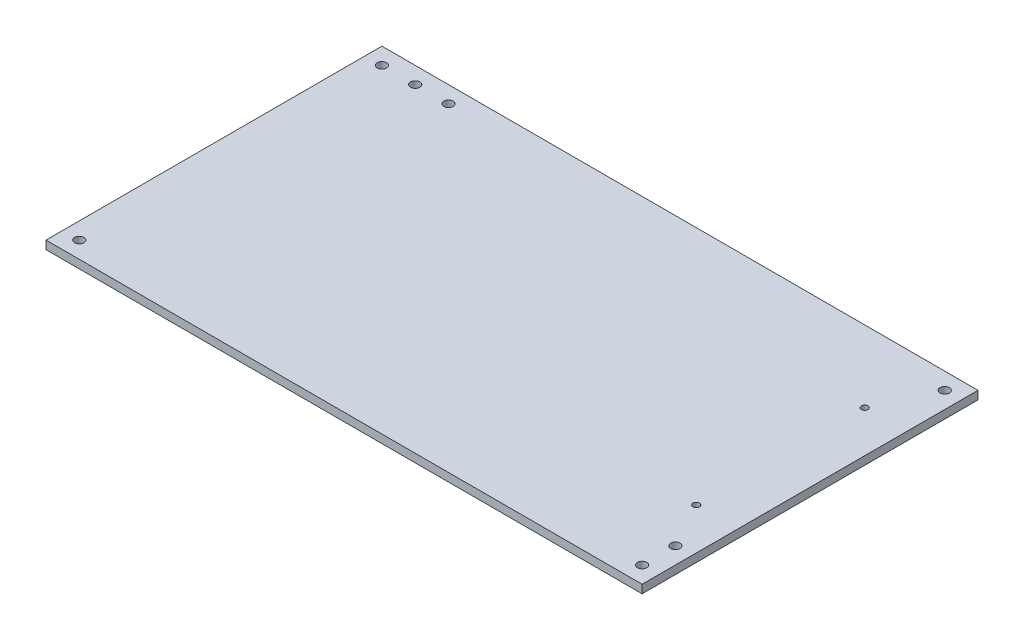
from build123d import *

# Parameters (mm, degrees)
BOSS_EXTRUDE1_START              = 19.05
SKETCH2_W                        = 600
SKETCH2_H                        = 256.45
BOSS_EXTRUDE1_DEPTH              = 6.35
BOSS_EXTRUDE2_START              = 19.05
SKETCH2_4_W                      = 455.092
SKETCH2_4_H                      = 256.45
BOSS_EXTRUDE2_DEPTH              = 6.35
BOSS_EXTRUDE3_START              = 19.05
SKETCH2_5_W                      = 455.092
SKETCH2_5_H                      = 300
BOSS_EXTRUDE3_DEPTH              = 6.35
SKETCH8_W                        = 3.5687
SKETCH8_H                        = 6.35
F_1_4_CLEARANCE_HOLE2_AT_2_COUNT = 2
F_1_4_CLEARANCE_HOLE2_AT_2_PITCH = 231.05
F_1_4_CLEARANCE_HOLE2_AT_3_COUNT = 2
F_1_4_CLEARANCE_HOLE2_AT_3_PITCH = 595.822744195
F_1_4_CLEARANCE_HOLE2_AT_4_COUNT = 2
F_1_4_CLEARANCE_HOLE2_AT_4_PITCH = 619.31354135
F_1_4_CLEARANCE_HOLE2_AT_5_COUNT = 2
F_1_4_CLEARANCE_HOLE2_AT_5_PITCH = 523.8
F_1_4_CLEARANCE_HOLE2_AT_6_COUNT = 2
F_1_4_CLEARANCE_HOLE2_AT_6_PITCH = 549.2
F_1_4_CLEARANCE_HOLE2_AT_7_COUNT = 2
F_1_4_CLEARANCE_HOLE2_AT_7_PITCH = 574.6
SKETCH10_W                       = 3.5687
SKETCH10_H                       = 6.35
F_1_4_CLEARANCE_HOLE3_AT_2_COUNT = 2
F_1_4_CLEARANCE_HOLE3_AT_2_PITCH = 25.4
F_1_4_CLEARANCE_HOLE3_AT_3_COUNT = 2
F_1_4_CLEARANCE_HOLE3_AT_3_PITCH = 50.8
F_1_4_CLEARANCE_HOLE3_AT_4_COUNT = 2
F_1_4_CLEARANCE_HOLE3_AT_4_PITCH = 231.05
F_1_4_CLEARANCE_HOLE3_AT_5_COUNT = 2
F_1_4_CLEARANCE_HOLE3_AT_5_PITCH = 487.872234672
F_1_4_CLEARANCE_HOLE3_AT_6_COUNT = 2
F_1_4_CLEARANCE_HOLE3_AT_6_PITCH = 476.368698976
F_1_4_CLEARANCE_HOLE3_AT_7_COUNT = 2
F_1_4_CLEARANCE_HOLE3_AT_7_PITCH = 429.692
SKETCH12_W                       = 3.5687
SKETCH12_H                       = 6.35
F_1_4_CLEARANCE_HOLE4_AT_2_COUNT = 2
F_1_4_CLEARANCE_HOLE4_AT_2_PITCH = 25.4
F_1_4_CLEARANCE_HOLE4_AT_3_COUNT = 2
F_1_4_CLEARANCE_HOLE4_AT_3_PITCH = 249.2
F_1_4_CLEARANCE_HOLE4_AT_4_COUNT = 2
F_1_4_CLEARANCE_HOLE4_AT_4_PITCH = 496.725130091
F_1_4_CLEARANCE_HOLE4_AT_5_COUNT = 2
F_1_4_CLEARANCE_HOLE4_AT_5_PITCH = 429.692
F_1_4_CLEARANCE_HOLE4_AT_6_COUNT = 2
F_1_4_CLEARANCE_HOLE4_AT_6_PITCH = 430.442069115
SKETCH14_W                       = 2.4892
SKETCH14_H                       = 6.35
F_8_CLEARANCE_HOLE2_AT_2_COUNT   = 2
F_8_CLEARANCE_HOLE2_AT_2_PITCH   = 128.5875
SKETCH16_W                       = 2.4892
SKETCH16_H                       = 6.35
F_8_CLEARANCE_HOLE3_AT_2_COUNT   = 2
F_8_CLEARANCE_HOLE3_AT_2_PITCH   = 128.5875
SKETCH17_R                       = 3.5687
BOSS_EXTRUDE4_DEPTH              = 6.35
FILLET2_R                        = 6.35
SKETCH18_W                       = 152.4
SKETCH18_H                       = 25.4
SKETCH18_R                       = 3.5687
BOSS_EXTRUDE5_DEPTH              = 6.35
SKETCH19_W                       = 25.4
SKETCH19_H                       = 101.6
SKETCH19_R                       = 3.5687
BOSS_EXTRUDE6_DEPTH              = 6.35


with BuildPart() as part:
    # Sketch2 → Boss-Extrude1 (new body)
    with BuildSketch(Plane(origin=(0, 0, 0), x_dir=(1, 0, 0), z_dir=(0, 1, 0)).offset(BOSS_EXTRUDE1_START)):
        with Locations((0, 278.225)):
            Rectangle(SKETCH2_W, SKETCH2_H)
    extrude(amount=BOSS_EXTRUDE1_DEPTH)

    # Sketch8 → 1/4 Clearance Hole2 (revolve, cut)
    with BuildSketch(Plane(origin=(-287.3, 25.4, -393.75), x_dir=(0, 0, 1), z_dir=(1, 0, 0))):
        with Locations((1.78435, 3.175)):
            Rectangle(SKETCH8_W, SKETCH8_H)
    f_1_4_clearance_hole2 = revolve(axis=Axis((-287.3, 31.75, -393.75), (0, -1, 0)), mode=Mode.SUBTRACT)

    # 1/4 Clearance Hole2 at 2: 1/4 Clearance Hole2 ×2
    with Locations(*[(0, 0, i * F_1_4_CLEARANCE_HOLE2_AT_2_PITCH) for i in range(1, F_1_4_CLEARANCE_HOLE2_AT_2_COUNT)]):
        add(f_1_4_clearance_hole2, mode=Mode.SUBTRACT)

    # 1/4 Clearance Hole2 at 3: 1/4 Clearance Hole2 ×2
    with Locations(*[Vector(0.9217506470687957, 0, 0.3877831154501913) * (i * F_1_4_CLEARANCE_HOLE2_AT_3_PITCH) for i in range(1, F_1_4_CLEARANCE_HOLE2_AT_3_COUNT)]):
        add(f_1_4_clearance_hole2, mode=Mode.SUBTRACT)

    # 1/4 Clearance Hole2 at 4: 1/4 Clearance Hole2 ×2
    with Locations(*[Vector(0.9278014473041833, 0, 0.37307435502894426) * (i * F_1_4_CLEARANCE_HOLE2_AT_4_PITCH) for i in range(1, F_1_4_CLEARANCE_HOLE2_AT_4_COUNT)]):
        add(f_1_4_clearance_hole2, mode=Mode.SUBTRACT)

    # 1/4 Clearance Hole2 at 5: 1/4 Clearance Hole2 ×2
    with Locations(*[(i * F_1_4_CLEARANCE_HOLE2_AT_5_PITCH, 0, 0) for i in range(1, F_1_4_CLEARANCE_HOLE2_AT_5_COUNT)]):
        add(f_1_4_clearance_hole2, mode=Mode.SUBTRACT)

    # 1/4 Clearance Hole2 at 6: 1/4 Clearance Hole2 ×2
    with Locations(*[(i * F_1_4_CLEARANCE_HOLE2_AT_6_PITCH, 0, 0) for i in range(1, F_1_4_CLEARANCE_HOLE2_AT_6_COUNT)]):
        add(f_1_4_clearance_hole2, mode=Mode.SUBTRACT)

    # 1/4 Clearance Hole2 at 7: 1/4 Clearance Hole2 ×2
    with Locations(*[(i * F_1_4_CLEARANCE_HOLE2_AT_7_PITCH, 0, 0) for i in range(1, F_1_4_CLEARANCE_HOLE2_AT_7_COUNT)]):
        add(f_1_4_clearance_hole2, mode=Mode.SUBTRACT)

    # Sketch14 → #8 Clearance Hole2 (revolve, cut)
    with BuildSketch(Plane(origin=(-268.25, 25.4, -351.68125), x_dir=(0, 0, 1), z_dir=(1, 0, 0))):
        with Locations((1.2446, 3.175)):
            Rectangle(SKETCH14_W, SKETCH14_H)
    f_8_clearance_hole2 = revolve(axis=Axis((-268.25, 31.75, -351.68125), (0, -1, 0)), mode=Mode.SUBTRACT)

    # #8 Clearance Hole2 at 2: #8 Clearance Hole2 ×2
    with Locations(*[(0, 0, i * F_8_CLEARANCE_HOLE2_AT_2_PITCH) for i in range(1, F_8_CLEARANCE_HOLE2_AT_2_COUNT)]):
        add(f_8_clearance_hole2, mode=Mode.SUBTRACT)


with BuildPart() as body_2:
    # Sketch2<4> → Boss-Extrude2 (new body)
    with BuildSketch(Plane(origin=(0, 0, 0), x_dir=(1, 0, 0), z_dir=(0, 1, 0)).offset(BOSS_EXTRUDE2_START)):
        with Locations((527.546, 278.225)):
            Rectangle(SKETCH2_4_W, SKETCH2_4_H)
    extrude(amount=BOSS_EXTRUDE2_DEPTH)

    # Sketch10 → 1/4 Clearance Hole3 (revolve, cut)
    with BuildSketch(Plane(origin=(312.7, 25.4, -393.75), x_dir=(0, 0, 1), z_dir=(1, 0, 0))):
        with Locations((1.78435, 3.175)):
            Rectangle(SKETCH10_W, SKETCH10_H)
    f_1_4_clearance_hole3 = revolve(axis=Axis((312.7, 31.75, -393.75), (0, -1, 0)), mode=Mode.SUBTRACT)

    # 1/4 Clearance Hole3 at 2: 1/4 Clearance Hole3 ×2
    with Locations(*[(i * F_1_4_CLEARANCE_HOLE3_AT_2_PITCH, 0, 0) for i in range(1, F_1_4_CLEARANCE_HOLE3_AT_2_COUNT)]):
        add(f_1_4_clearance_hole3, mode=Mode.SUBTRACT)

    # 1/4 Clearance Hole3 at 3: 1/4 Clearance Hole3 ×2
    with Locations(*[(i * F_1_4_CLEARANCE_HOLE3_AT_3_PITCH, 0, 0) for i in range(1, F_1_4_CLEARANCE_HOLE3_AT_3_COUNT)]):
        add(f_1_4_clearance_hole3, mode=Mode.SUBTRACT)

    # 1/4 Clearance Hole3 at 4: 1/4 Clearance Hole3 ×2
    with Locations(*[(0, 0, i * F_1_4_CLEARANCE_HOLE3_AT_4_PITCH) for i in range(1, F_1_4_CLEARANCE_HOLE3_AT_4_COUNT)]):
        add(f_1_4_clearance_hole3, mode=Mode.SUBTRACT)

    # 1/4 Clearance Hole3 at 5: 1/4 Clearance Hole3 ×2
    with Locations(*[Vector(0.880746985506873, 0, 0.47358710658183684) * (i * F_1_4_CLEARANCE_HOLE3_AT_5_PITCH) for i in range(1, F_1_4_CLEARANCE_HOLE3_AT_5_COUNT)]):
        add(f_1_4_clearance_hole3, mode=Mode.SUBTRACT)

    # 1/4 Clearance Hole3 at 6: 1/4 Clearance Hole3 ×2
    with Locations(*[Vector(0.9020156045595491, 0, 0.4317034272866863) * (i * F_1_4_CLEARANCE_HOLE3_AT_6_PITCH) for i in range(1, F_1_4_CLEARANCE_HOLE3_AT_6_COUNT)]):
        add(f_1_4_clearance_hole3, mode=Mode.SUBTRACT)

    # 1/4 Clearance Hole3 at 7: 1/4 Clearance Hole3 ×2
    with Locations(*[(i * F_1_4_CLEARANCE_HOLE3_AT_7_PITCH, 0, 0) for i in range(1, F_1_4_CLEARANCE_HOLE3_AT_7_COUNT)]):
        add(f_1_4_clearance_hole3, mode=Mode.SUBTRACT)

    # Sketch16 → #8 Clearance Hole3 (revolve, cut)
    with BuildSketch(Plane(origin=(723.342, 25.4, -351.68125), x_dir=(0, 0, 1), z_dir=(1, 0, 0))):
        with Locations((1.2446, 3.175)):
            Rectangle(SKETCH16_W, SKETCH16_H)
    f_8_clearance_hole3 = revolve(axis=Axis((723.342, 31.75, -351.68125), (0, -1, 0)), mode=Mode.SUBTRACT)

    # #8 Clearance Hole3 at 2: #8 Clearance Hole3 ×2
    with Locations(*[(0, 0, i * F_8_CLEARANCE_HOLE3_AT_2_PITCH) for i in range(1, F_8_CLEARANCE_HOLE3_AT_2_COUNT)]):
        add(f_8_clearance_hole3, mode=Mode.SUBTRACT)


with BuildPart() as body_3:
    # Sketch2<5> → Boss-Extrude3 (new body)
    with BuildSketch(Plane(origin=(0, 0, 0), x_dir=(1, 0, 0), z_dir=(0, 1, 0)).offset(BOSS_EXTRUDE3_START)):
        with Locations((527.546, 0)):
            Rectangle(SKETCH2_5_W, SKETCH2_5_H)
    extrude(amount=BOSS_EXTRUDE3_DEPTH)

    # Sketch12 → 1/4 Clearance Hole4 (revolve, cut)
    with BuildSketch(Plane(origin=(312.7, 25.4, -111.9), x_dir=(0, 0, 1), z_dir=(1, 0, 0))):
        with Locations((1.78435, 3.175)):
            Rectangle(SKETCH12_W, SKETCH12_H)
    f_1_4_clearance_hole4 = revolve(axis=Axis((312.7, 31.75, -111.9), (0, -1, 0)), mode=Mode.SUBTRACT)

    # 1/4 Clearance Hole4 at 2: 1/4 Clearance Hole4 ×2
    with Locations(*[(0, 0, -i * F_1_4_CLEARANCE_HOLE4_AT_2_PITCH) for i in range(1, F_1_4_CLEARANCE_HOLE4_AT_2_COUNT)]):
        add(f_1_4_clearance_hole4, mode=Mode.SUBTRACT)

    # 1/4 Clearance Hole4 at 3: 1/4 Clearance Hole4 ×2
    with Locations(*[(0, 0, i * F_1_4_CLEARANCE_HOLE4_AT_3_PITCH) for i in range(1, F_1_4_CLEARANCE_HOLE4_AT_3_COUNT)]):
        add(f_1_4_clearance_hole4, mode=Mode.SUBTRACT)

    # 1/4 Clearance Hole4 at 4: 1/4 Clearance Hole4 ×2
    with Locations(*[Vector(0.865049851456502, 0, 0.5016859121951541) * (i * F_1_4_CLEARANCE_HOLE4_AT_4_PITCH) for i in range(1, F_1_4_CLEARANCE_HOLE4_AT_4_COUNT)]):
        add(f_1_4_clearance_hole4, mode=Mode.SUBTRACT)

    # 1/4 Clearance Hole4 at 5: 1/4 Clearance Hole4 ×2
    with Locations(*[(i * F_1_4_CLEARANCE_HOLE4_AT_5_PITCH, 0, 0) for i in range(1, F_1_4_CLEARANCE_HOLE4_AT_5_COUNT)]):
        add(f_1_4_clearance_hole4, mode=Mode.SUBTRACT)

    # 1/4 Clearance Hole4 at 6: 1/4 Clearance Hole4 ×2
    with Locations(*[Vector(0.998257444685787, 0, -0.05900910208944768) * (i * F_1_4_CLEARANCE_HOLE4_AT_6_PITCH) for i in range(1, F_1_4_CLEARANCE_HOLE4_AT_6_COUNT)]):
        add(f_1_4_clearance_hole4, mode=Mode.SUBTRACT)


with BuildPart() as body_4:
    # Sketch17 → Boss-Extrude4 (new body)
    with BuildSketch(Plane(origin=(0, 25.4, 0), x_dir=(1, 0, 0), z_dir=(0, 1, 0))):
        Polygon((249.2, 150), (249.2, 175.4), (325.4, 175.4), (325.4, 99.2), (300, 99.2), (300, 150), align=None)
        with Locations(Location((261.9, 162.7, 0), (0, 0, 270))):
            Circle(SKETCH17_R, mode=Mode.SUBTRACT)
        with Locations(Location((287.3, 162.7, 0), (0, 0, 270))):
            Circle(SKETCH17_R, mode=Mode.SUBTRACT)
        with Locations(Location((312.7, 162.7, 0), (0, 0, 270))):
            Circle(SKETCH17_R, mode=Mode.SUBTRACT)
        with Locations(Location((312.7, 137.3, 0), (0, 0, 270))):
            Circle(SKETCH17_R, mode=Mode.SUBTRACT)
        with Locations(Location((312.7, 111.9, 0), (0, 0, 270))):
            Circle(SKETCH17_R, mode=Mode.SUBTRACT)
    extrude(amount=BOSS_EXTRUDE4_DEPTH)

    # Fillet2
    fillet2_edges = [body_4.edges().sort_by_distance(p)[0] for p in [
        (249.2, 28.575, -150),
        (249.2, 28.575, -175.4),
        (325.4, 28.575, -175.4),
        (325.4, 28.575, -99.2),
        (300, 28.575, -99.2),
    ]]
    fillet(fillet2_edges, radius=FILLET2_R)


with BuildPart() as body_5:
    # Sketch18 → Boss-Extrude5 (new body)
    with BuildSketch(Plane(origin=(0, 25.4, 0), x_dir=(1, 0, 0), z_dir=(0, 1, 0))):
        with Locations((300, 393.75)):
            Rectangle(SKETCH18_W, SKETCH18_H)
        with Locations(Location((236.5, 393.75, 0), (0, 0, 270))):
            Circle(SKETCH18_R, mode=Mode.SUBTRACT)
        with Locations(Location((261.9, 393.75, 0), (0, 0, 270))):
            Circle(SKETCH18_R, mode=Mode.SUBTRACT)
        with Locations(Location((287.3, 393.75, 0), (0, 0, 270))):
            Circle(SKETCH18_R, mode=Mode.SUBTRACT)
        with Locations(Location((312.7, 393.75, 0), (0, 0, 270))):
            Circle(SKETCH18_R, mode=Mode.SUBTRACT)
        with Locations(Location((338.1, 393.75, 0), (0, 0, 270))):
            Circle(SKETCH18_R, mode=Mode.SUBTRACT)
        with Locations(Location((363.5, 393.75, 0), (0, 0, 270))):
            Circle(SKETCH18_R, mode=Mode.SUBTRACT)
    extrude(amount=BOSS_EXTRUDE5_DEPTH)


with BuildPart() as body_6:
    # Sketch19 → Boss-Extrude6 (new body)
    with BuildSketch(Plane(origin=(0, 25.4, 0), x_dir=(1, 0, 0), z_dir=(0, 1, 0))):
        with Locations((742.392, 150)):
            Rectangle(SKETCH19_W, SKETCH19_H)
        with Locations((742.392, 111.9)):
            Circle(SKETCH19_R, mode=Mode.SUBTRACT)
        with Locations((742.392, 137.3)):
            Circle(SKETCH19_R, mode=Mode.SUBTRACT)
        with Locations(Location((742.392, 162.7, 0), (0, 0, 270))):
            Circle(SKETCH19_R, mode=Mode.SUBTRACT)
        with Locations(Location((742.392, 188.1, 0), (0, 0, 270))):
            Circle(SKETCH19_R, mode=Mode.SUBTRACT)
    extrude(amount=BOSS_EXTRUDE6_DEPTH)


solid = body_2.part
